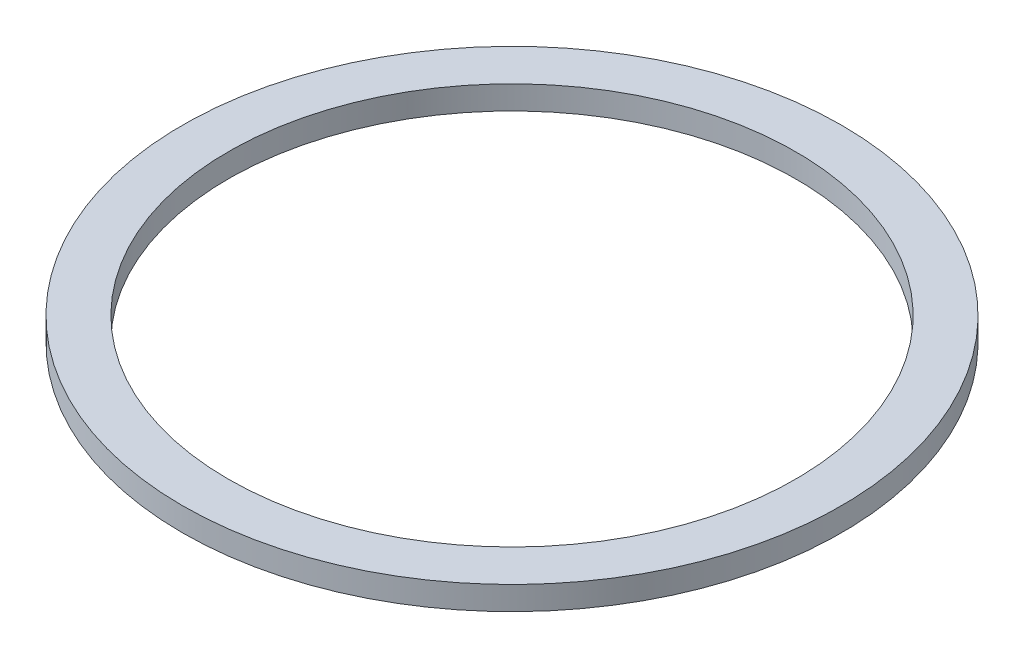
from build123d import *

# Parameters (mm, degrees)
SKETCH1_R           = 14
SKETCH1_R_2         = 12.05
BOSS_EXTRUDE1_DEPTH = 1


with BuildPart() as part:
    # Sketch1 → Boss-Extrude1 (new body)
    with BuildSketch(Plane(origin=(0, 0, 0), x_dir=(1, 0, 0), z_dir=(0, 1, 0))):
        with Locations(Location((0, 0, 0), (0, 0, 270))):
            Circle(SKETCH1_R)
        with Locations(Location((0, 0, 0), (0, 0, 270))):
            Circle(SKETCH1_R_2, mode=Mode.SUBTRACT)
    extrude(amount=BOSS_EXTRUDE1_DEPTH)


solid = part.part
